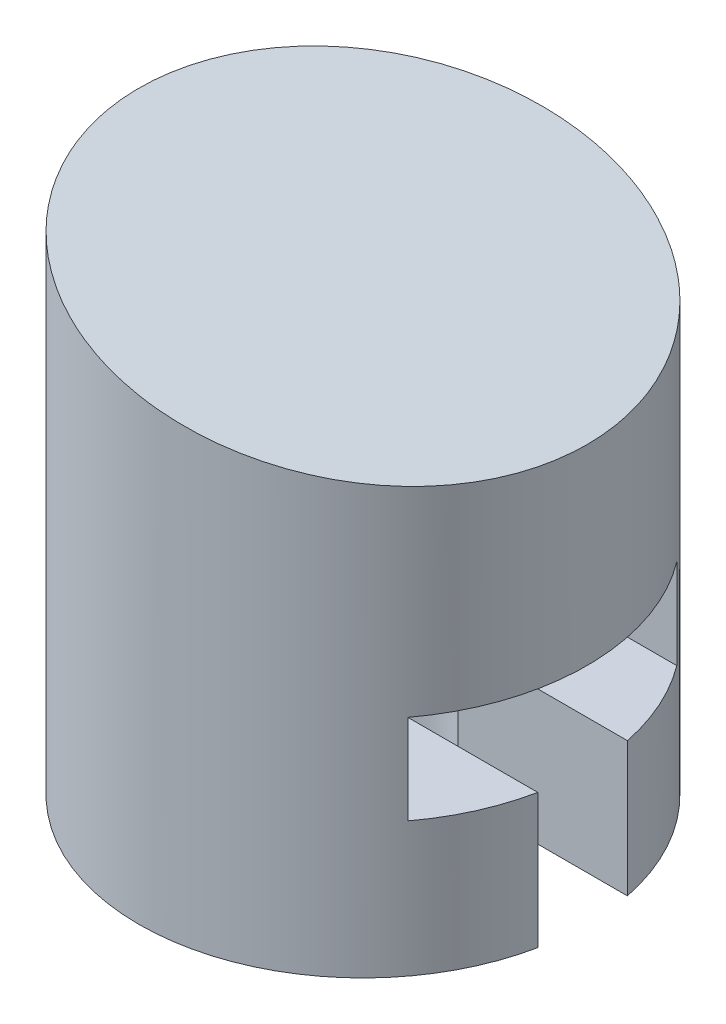
from build123d import *

# Parameters (mm, degrees)
BOSS_EXTRUDE1_DEPTH     = 6
SHELL1_T                = 2
BOSS_EXTRUDE2_DEPTH     = 12
CUT_EXTRUDE1_DEPTH      = 105.548062061
CUT_EXTRUDE1_DEPTH_BACK = 105.548062061
SKETCH4_OUTSIDE_W       = 127.703
SKETCH4_OUTSIDE_H       = 47.702
SKETCH4_OUTSIDE_R       = 5
BOSS_EXTRUDE3_START     = -3
SKETCH5_R               = 5
BOSS_EXTRUDE3_DEPTH     = 3
SKETCH8_W               = 2
SKETCH8_H               = 3
CUT_EXTRUDE2_DEPTH      = 20.507580381


with BuildPart() as part:
    # Sketch1 → Boss-Extrude1 (new, symmetric)
    with BuildSketch(Plane.XY):
        with BuildLine():
            add(Edge.make_bspline(
                [(0, 0), (-0.020523105, 1.211959263), (0.67437266, 2.857215342), (1.905623999, 4.78389108), (3.228212227, 6.302382051), (4.893886607, 7.740810658), (7.226107258, 9.264300756), (10.552653396, 10.717178582), (14.932037071, 11.831530653), (19.991297272, 12.255898832), (25.003683181, 12.218808276), (31.681712165, 11.857586647), (40.030453626, 10.974271434), (50.024814986, 9.447886993), (60.008390595, 7.611152922), (69.999350586, 5.696721586), (83.333766276, 3.168852276), (93.333116862, 1.265573862), (100, 0)],
                knots=[0, 0, 0, 0, 0.032626759, 0.049882871, 0.06427589, 0.089250813, 0.111667998, 0.142584384, 0.191135501, 0.238340392, 0.285329255, 0.332381604, 0.426846937, 0.521876031, 0.61736406, 0.713023045, 0.80868203, 1, 1, 1, 1], degree=3))
            add(Edge.make_bspline(
                [(0, 0), (0.036655271, -0.696109017), (0.772960092, -1.382467179), (1.96178056, -1.978761756), (3.324506087, -2.315299728), (4.988662397, -2.651222943), (7.325816413, -2.960951495), (10.662744647, -3.183232196), (14.999725999, -3.252330394), (19.999719582, -3.317988032), (25.00025256, -3.335705262), (31.666881467, -3.233674), (40.002372591, -3.118326111), (50.001627017, -2.749659581), (60.002529003, -2.322582922), (69.997554247, -1.759547439), (83.37248003, -1.331343132), (93.243437862, 0.963839901), (100, 0)],
                knots=[0, 0, 0, 0, 0.017855622, 0.028908701, 0.039175102, 0.059339021, 0.079290733, 0.109028899, 0.158476478, 0.20791091, 0.257341883, 0.306776316, 0.405654078, 0.504572951, 0.603530351, 0.702515599, 0.801543493, 1, 1, 1, 1], degree=3))
        make_face()
    extrude(amount=BOSS_EXTRUDE1_DEPTH, both=True)

    # Shell1
    shell1_openings = [part.faces().sort_by_distance(p)[0] for p in [
        (38.486858992, 3.393824358, 6),
        (38.486858992, 3.393824358, -6),
    ]]
    offset(amount=SHELL1_T, openings=shell1_openings)

    # Sketch3 → Boss-Extrude2 (add)
    with BuildSketch(Plane.XY.offset(6)):
        with BuildLine():
            add(Edge.make_bspline(
                [(0, 0), (0.036655271, -0.696109017), (0.772960092, -1.382467179), (1.96178056, -1.978761756), (3.324506087, -2.315299728), (4.988662397, -2.651222943), (7.325816413, -2.960951495), (10.662744647, -3.183232196), (14.999725999, -3.252330394), (19.999719582, -3.317988032), (25.00025256, -3.335705262), (31.666881467, -3.233674), (40.002372591, -3.118326111), (50.001627017, -2.749659581), (60.002529003, -2.322582922), (69.997554247, -1.759547439), (83.37248003, -1.331343132), (93.243437862, 0.963839901), (100, 0)],
                knots=[0, 0, 0, 0, 0.017855622, 0.028908701, 0.039175102, 0.059339021, 0.079290733, 0.109028899, 0.158476478, 0.20791091, 0.257341883, 0.306776316, 0.405654078, 0.504572951, 0.603530351, 0.702515599, 0.801543493, 1, 1, 1, 1], degree=3))
            add(Edge.make_bspline(
                [(100, 0), (93.333116862, 1.265573862), (83.333766276, 3.168852276), (69.999350586, 5.696721586), (60.008390595, 7.611152922), (50.024814986, 9.447886993), (40.030453626, 10.974271434), (31.681712165, 11.857586647), (25.003683181, 12.218808276), (19.991297272, 12.255898832), (14.932037071, 11.831530653), (10.552653396, 10.717178582), (7.226107258, 9.264300756), (4.893886607, 7.740810658), (3.228212227, 6.302382051), (1.905623999, 4.78389108), (0.67437266, 2.857215342), (-0.020523105, 1.211959263), (0, 0)],
                knots=[0, 0, 0, 0, 0.19131797, 0.286976955, 0.38263594, 0.478123969, 0.573153063, 0.667618396, 0.714670745, 0.761659608, 0.808864499, 0.857415616, 0.888332002, 0.910749187, 0.93572411, 0.950117129, 0.967373241, 1, 1, 1, 1], degree=3))
        make_face()
    extrude(amount=BOSS_EXTRUDE2_DEPTH)

    # Sketch4 outside → Cut-Extrude1 (cut, two sides: drawn at the far end of the back side and taken through both)
    with BuildSketch(Plane(origin=(0, 0, 0), x_dir=(1, 0, 0), z_dir=(0, 1, 0)).offset(-CUT_EXTRUDE1_DEPTH_BACK)):
        with Locations((49.9995, -6)):
            Rectangle(SKETCH4_OUTSIDE_W, SKETCH4_OUTSIDE_H)
        with Locations(Location((62.007047228, -12, 0), (0, 0, 270))):
            Circle(SKETCH4_OUTSIDE_R, mode=Mode.SUBTRACT)
    extrude(amount=CUT_EXTRUDE1_DEPTH + CUT_EXTRUDE1_DEPTH_BACK, mode=Mode.SUBTRACT)

    # Sketch5 → Boss-Extrude3 (add)
    with BuildSketch(Plane(origin=(0, 0, 0), x_dir=(1, 0, 0), z_dir=(0, 1, 0)).offset(BOSS_EXTRUDE3_START)):
        with Locations(Location((62.007047228, -12, 0), (0, 0, 270))):
            Circle(SKETCH5_R)
    extrude(amount=BOSS_EXTRUDE3_DEPTH)

    # Sketch6 → Cut-Revolve3 (revolve, cut)
    with BuildSketch(Plane(origin=(62.007047228, 0, 0), x_dir=(0, 0, -1), z_dir=(1, 0, 0))):
        Polygon((-12, 2), (-12, -3), (-10.5, -3), (-10.5, 0), (-9, 0), (-9, 2), align=None)
    revolve(axis=Axis((62.007047228, 2, 12), (0, -1, 0)), mode=Mode.SUBTRACT)

    # Sketch8 → Cut-Extrude2 (cut, through all)
    with BuildSketch(Plane(origin=(62.007047228, 0, 0), x_dir=(0, 0, -1), z_dir=(1, 0, 0))):
        Polygon((-15, 0), (-13, 0), (-11, 0), (-9, 0), (-9, 2), (-15, 2), align=None)
        with Locations((-12, -1.5)):
            Rectangle(SKETCH8_W, SKETCH8_H)
    extrude(amount=CUT_EXTRUDE2_DEPTH, mode=Mode.SUBTRACT)


solid = part.part
